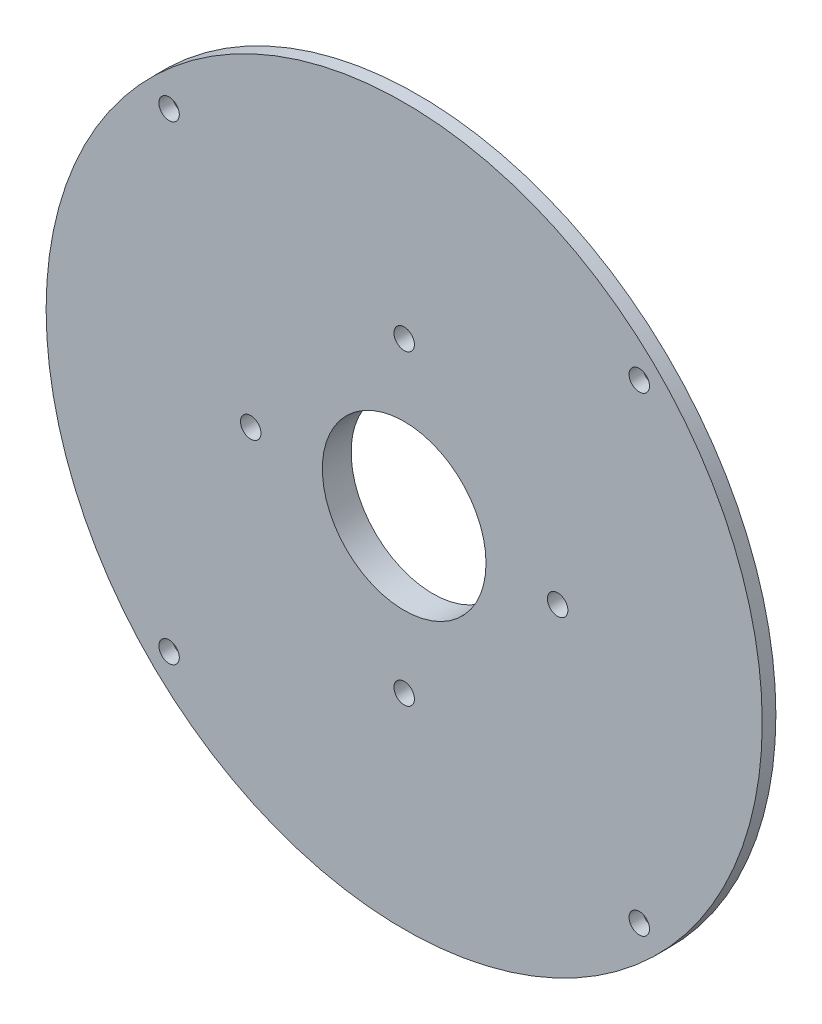
from build123d import *

# Parameters (mm, degrees)
SKETCH1_R           = 30.625
SKETCH1_R_2         = 12
BOSS_EXTRUDE1_DEPTH = 4.22
SKETCH1_4_R         = 52.5
SKETCH1_4_R_2       = 30.625
BOSS_EXTRUDE2_DEPTH = 2
SKETCH2_R           = 1.5
CUT_EXTRUDE1_DEPTH  = 20


with BuildPart() as part:
    # Sketch1 → Boss-Extrude1 (new body)
    with BuildSketch(Plane.XY):
        Circle(SKETCH1_R)
        Circle(SKETCH1_R_2, mode=Mode.SUBTRACT)
    extrude(amount=-BOSS_EXTRUDE1_DEPTH)

    # Sketch1<4> → Boss-Extrude2 (add)
    with BuildSketch(Plane.XY):
        Circle(SKETCH1_4_R)
        Circle(SKETCH1_4_R_2, mode=Mode.SUBTRACT)
    extrude(amount=-BOSS_EXTRUDE2_DEPTH)

    # Sketch2 → Cut-Extrude1 (cut)
    with BuildSketch(Plane.XY):
        with Locations((-34.471455583, 34.471455583)):
            Circle(SKETCH2_R)
        with Locations((34.471455583, 34.471455583)):
            Circle(SKETCH2_R)
        with Locations((34.471455583, -34.471455583)):
            Circle(SKETCH2_R)
        with Locations((-34.471455583, -34.471455583)):
            Circle(SKETCH2_R)
        with Locations((0, 22.5)):
            Circle(SKETCH2_R)
        with Locations((22.5, 0)):
            Circle(SKETCH2_R)
        with Locations((0, -22.5)):
            Circle(SKETCH2_R)
        with Locations((-22.5, 0)):
            Circle(SKETCH2_R)
    extrude(amount=-CUT_EXTRUDE1_DEPTH, mode=Mode.SUBTRACT)


solid = part.part
